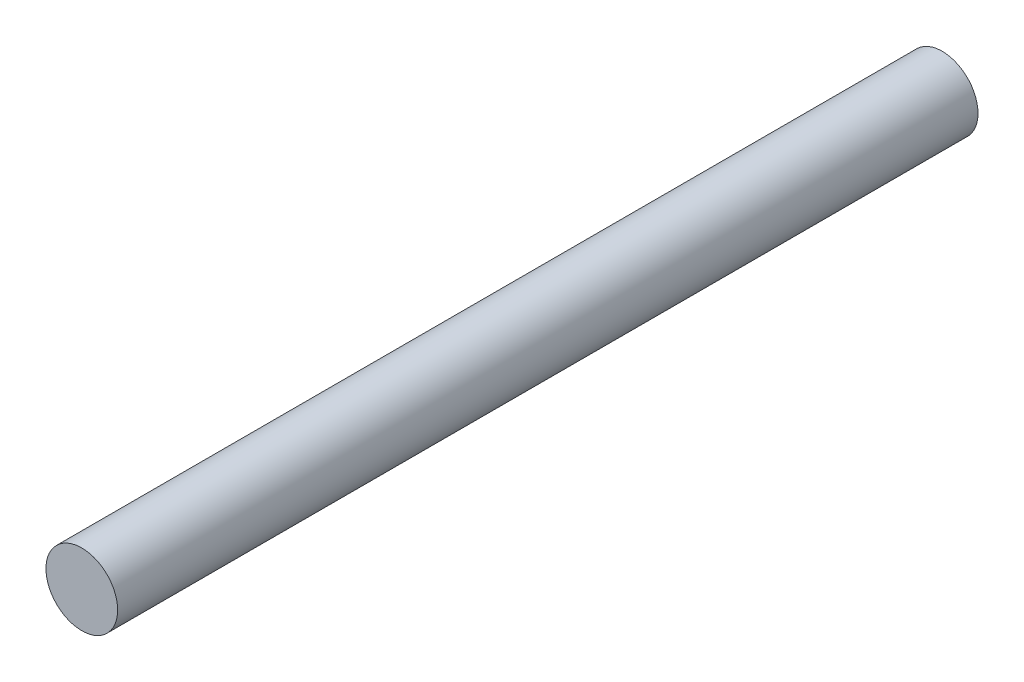
from build123d import *

# Parameters (mm, degrees)
SKETCH1_R           = 1.25
BOSS_EXTRUDE1_DEPTH = 30


with BuildPart() as part:
    # Sketch1 → Boss-Extrude1 (new body)
    with BuildSketch(Plane.XY):
        Circle(SKETCH1_R)
    extrude(amount=BOSS_EXTRUDE1_DEPTH)


solid = part.part
